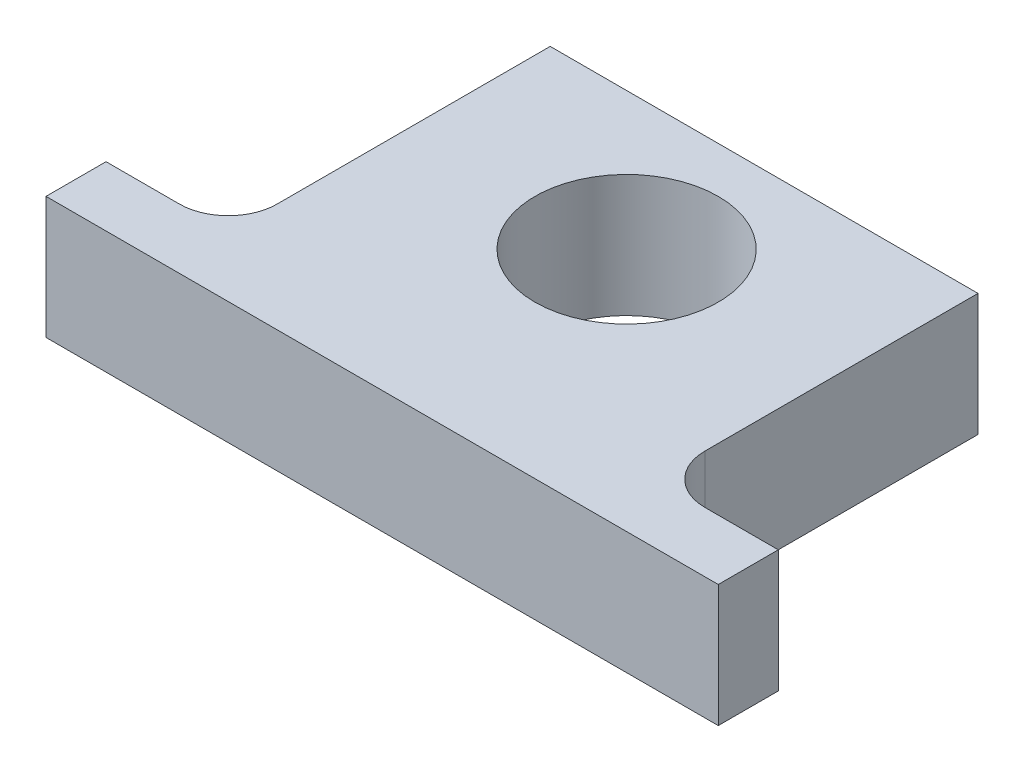
from build123d import *

# Parameters (mm, degrees)
SKETCH1_R           = 9.525
BOSS_EXTRUDE1_DEPTH = 12.7


with BuildPart() as part:
    # Sketch1 → Boss-Extrude1 (new body)
    with BuildSketch(Plane(origin=(0, 0, 0), x_dir=(1, 0, 0), z_dir=(0, 1, 0))):
        with BuildLine():
            Line((22.225, -8.525568981), (22.225, 19.84375))
            Line((22.225, 19.84375), (-22.225, 19.84375))
            Line((-22.225, 19.84375), (-22.225, -8.525568981))
            ThreePointArc((-22.225, -8.525568981), (-23.712897552, -12.117671429), (-27.305, -13.605568981))
            Line((-27.305, -13.605568981), (-34.925, -13.605568981))
            Line((-34.925, -13.605568981), (-34.925, -19.84375))
            Line((-34.925, -19.84375), (34.925, -19.84375))
            Line((34.925, -19.84375), (34.925, -13.605568981))
            Line((34.925, -13.605568981), (27.305, -13.605568981))
            ThreePointArc((27.305, -13.605568981), (23.712897552, -12.117671429), (22.225, -8.525568981))
        make_face()
        with Locations(Location((0, 5.55625, 0), (0, 0, 270))):
            Circle(SKETCH1_R, mode=Mode.SUBTRACT)
    extrude(amount=BOSS_EXTRUDE1_DEPTH)


solid = part.part
